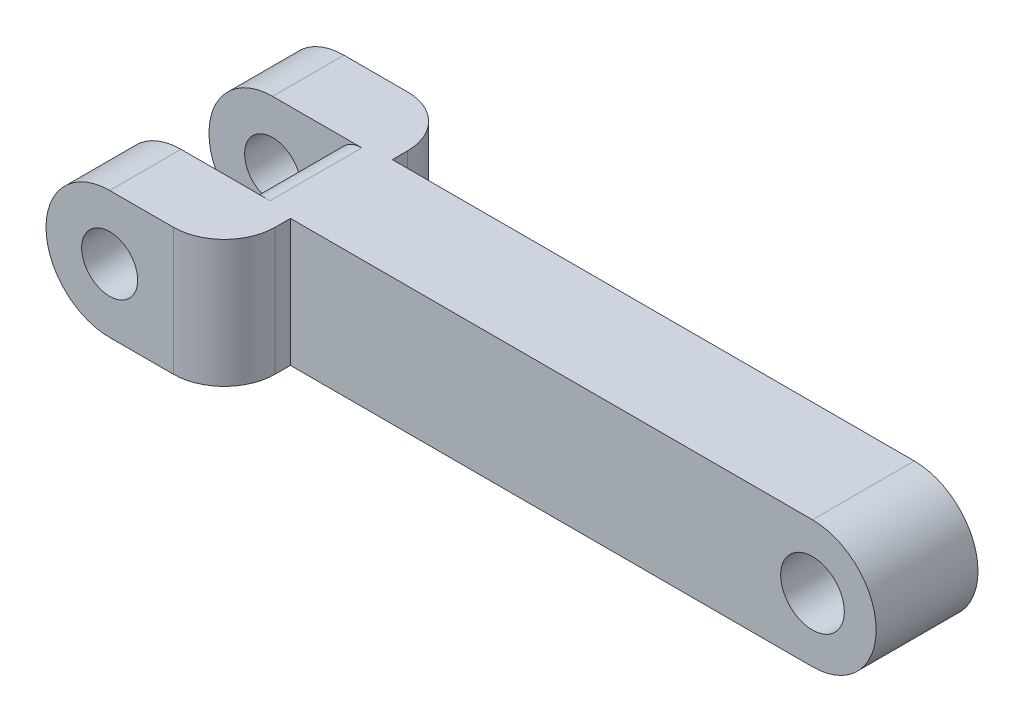
from build123d import *

# Parameters (mm, degrees)
BOSS_EXTRUDE1_DEPTH = 2.5
SKETCH2_R           = 1.1
SKETCH2_R_2         = 1.25
CUT_EXTRUDE1_DEPTH  = 21.81201576
FILLET3_RADIUS      = 2.5
FILLET3_LENGTH      = 2.8
FILLET4_RADIUS      = 2.5
FILLET4_LENGTH      = 2.8
FILLET5_RADIUS      = 2.5
FILLET5_LENGTH      = 4
FILLET6_R           = 2
FILLET7_R           = 2
FILLET8_R           = 1


with BuildPart() as part:
    # Sketch1 → Boss-Extrude1 (new, symmetric)
    with BuildSketch(Plane(origin=(0, 0, 0), x_dir=(1, 0, 0), z_dir=(0, 1, 0))):
        Polygon((11.5, 2), (-11.5, 2), (-11.5, 4.6), (-18.5, 4.6), (-18.5, 1.8), (-13.5, 1.8), (-13.5, -1.8), (-18.5, -1.8), (-18.5, -4.6), (-11.5, -4.6), (-11.5, -2), (11.5, -2), align=None)
    extrude(amount=BOSS_EXTRUDE1_DEPTH, both=True)

    # Sketch2 → Cut-Extrude1 (cut, through all)
    with BuildSketch(Plane.XY.offset(4.6)):
        with Locations((-16, 0)):
            Circle(SKETCH2_R)
        with Locations((9, 0)):
            Circle(SKETCH2_R_2)
    extrude(amount=-CUT_EXTRUDE1_DEPTH, mode=Mode.SUBTRACT)

    # Fillet3: full round fillet: the end face becomes a half cylinder, R = half its width
    fillet3_face = Plane((-18.5, 0, -3.2), x_dir=(0, 0, 1), z_dir=(-1, 0, 0))  # on the end face: x along it, z out of the body
    fillet3_slab = fillet3_face.offset(-FILLET3_RADIUS / 2) * Box(FILLET3_LENGTH, 2 * FILLET3_RADIUS, FILLET3_RADIUS, mode=Mode.PRIVATE)  # the body's end, R deep
    fillet3_round = Plane((-16, 0, -3.2), x_dir=(-1, 0, 0), z_dir=(0, 0, 1)) * Cylinder(FILLET3_RADIUS, FILLET3_LENGTH, mode=Mode.PRIVATE)  # its axis R under the face
    add(fillet3_slab - fillet3_round, mode=Mode.SUBTRACT)

    # Fillet4: full round fillet: the end face becomes a half cylinder, R = half its width
    fillet4_face = Plane((-18.5, 0, 3.2), x_dir=(0, 0, 1), z_dir=(-1, 0, 0))  # on the end face: x along it, z out of the body
    fillet4_slab = fillet4_face.offset(-FILLET4_RADIUS / 2) * Box(FILLET4_LENGTH, 2 * FILLET4_RADIUS, FILLET4_RADIUS, mode=Mode.PRIVATE)  # the body's end, R deep
    fillet4_round = Plane((-16, 0, 3.2), x_dir=(-1, 0, 0), z_dir=(0, 0, 1)) * Cylinder(FILLET4_RADIUS, FILLET4_LENGTH, mode=Mode.PRIVATE)  # its axis R under the face
    add(fillet4_slab - fillet4_round, mode=Mode.SUBTRACT)

    # Fillet5: full round fillet: the end face becomes a half cylinder, R = half its width
    fillet5_face = Plane((11.5, 0, 0), x_dir=(0, 0, 1), z_dir=(1, 0, 0))  # on the end face: x along it, z out of the body
    fillet5_slab = fillet5_face.offset(-FILLET5_RADIUS / 2) * Box(FILLET5_LENGTH, 2 * FILLET5_RADIUS, FILLET5_RADIUS, mode=Mode.PRIVATE)  # the body's end, R deep
    fillet5_round = Plane((9, 0, 0), x_dir=(1, 0, 0), z_dir=(0, 0, 1)) * Cylinder(FILLET5_RADIUS, FILLET5_LENGTH, mode=Mode.PRIVATE)  # its axis R under the face
    add(fillet5_slab - fillet5_round, mode=Mode.SUBTRACT)

    # Fillet6
    fillet6_edges = [part.edges().sort_by_distance(p)[0] for p in [
        (-11.5, 0, 4.6),
    ]]
    fillet(fillet6_edges, radius=FILLET6_R)

    # Fillet7
    fillet7_edges = [part.edges().sort_by_distance(p)[0] for p in [
        (-11.5, 0, -4.6),
    ]]
    fillet(fillet7_edges, radius=FILLET7_R)

    # Fillet8
    fillet8_edges = [part.edges().sort_by_distance(p)[0] for p in [
        (-13.5, -2.5, 0),
        (-13.5, 2.5, 0),
    ]]
    fillet(fillet8_edges, radius=FILLET8_R)


solid = part.part
